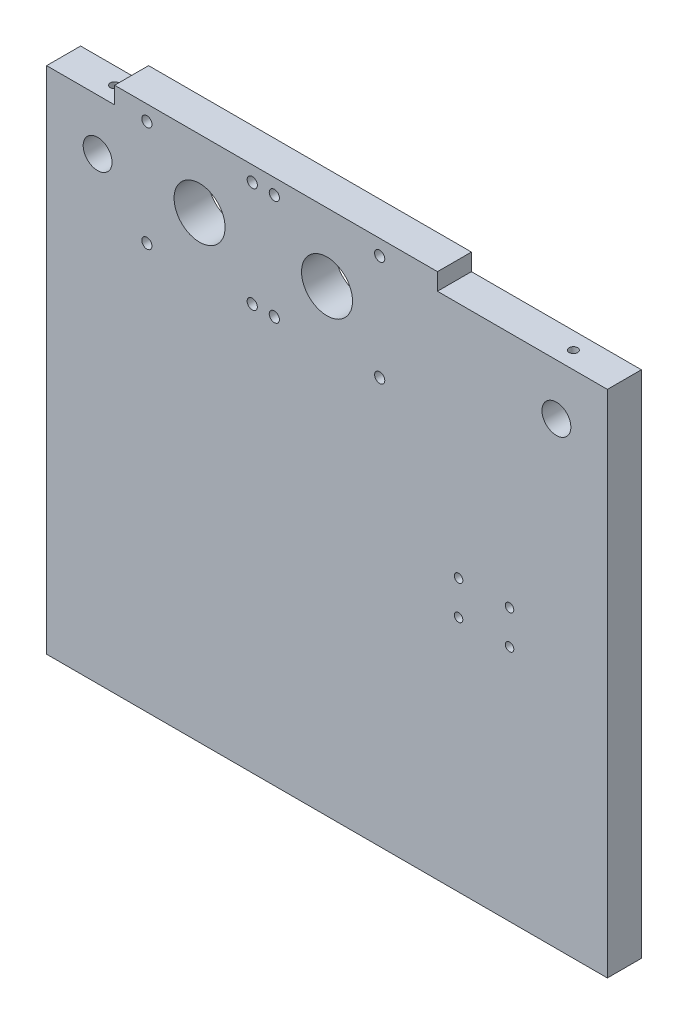
from build123d import *

# Parameters (mm, degrees)
ESQUISSE1_W             = 165
ESQUISSE1_H             = 150
BOSS_EXTRU_1_DEPTH      = 10
ESQUISSE2_R             = 4.25
ENL_V_MAT_EXTRU_1_DEPTH = 10
ESQUISSE5_W             = 95
ESQUISSE5_H             = 10
BOSS_EXTRU_2_DEPTH      = 5
ESQUISSE4_R             = 1.5
ESQUISSE4_R_2           = 7.5
ENL_V_MAT_EXTRU_2_DEPTH = 15
ESQUISSE6_R             = 1.25
ENL_V_MAT_EXTRU_3_DEPTH = 10
ESQUISSE7_W             = 30
ESQUISSE7_H             = 20
BOSS_EXTRU_3_DEPTH      = 30
ESQUISSE8_R             = 5.5
ESQUISSE8_R_2           = 2
ENL_V_MAT_EXTRU_4_DEPTH = 30
ESQUISSE8_4_R           = 11.5
ESQUISSE8_4_R_2         = 5.5
ESQUISSE8_4_R_3         = 2
ENL_V_MAT_EXTRU_5_DEPTH = 5
ESQUISSE9_R             = 1.25
ENL_V_MAT_EXTRU_6_DEPTH = 15


with BuildPart() as part:
    # Esquisse1 → Boss.-Extru.1 (new body)
    with BuildSketch(Plane.XY):
        Rectangle(ESQUISSE1_W, ESQUISSE1_H)
    extrude(amount=BOSS_EXTRU_1_DEPTH)

    # Esquisse2 → Enlèv. mat.-Extru.1 (cut)
    with BuildSketch(Plane.XY.offset(10)):
        with Locations((-67.5, 60)):
            Circle(ESQUISSE2_R)
        with Locations((67.5, 60)):
            Circle(ESQUISSE2_R)
    extrude(amount=-ENL_V_MAT_EXTRU_1_DEPTH, mode=Mode.SUBTRACT)

    # Esquisse5 → Boss.-Extru.2 (add)
    with BuildSketch(Plane(origin=(0, 75, 0), x_dir=(1, 0, 0), z_dir=(0, 1, 0))):
        with Locations((-15, -5)):
            Rectangle(ESQUISSE5_W, ESQUISSE5_H)
    extrude(amount=BOSS_EXTRU_2_DEPTH)

    # Esquisse4 → Enlèv. mat.-Extru.2 (cut)
    with BuildSketch(Plane.XY.offset(10)):
        with Locations((-15.5, 75.5)):
            Circle(ESQUISSE4_R)
        with Locations((15.5, 75.5)):
            Circle(ESQUISSE4_R)
        with Locations((15.5, 44.5)):
            Circle(ESQUISSE4_R)
        with Locations((-15.5, 44.5)):
            Circle(ESQUISSE4_R)
        with Locations((0, 60)):
            Circle(ESQUISSE4_R_2)
        with Locations((-53, 75.5)):
            Circle(ESQUISSE4_R)
        with Locations((-22, 75.5)):
            Circle(ESQUISSE4_R)
        with Locations((-22, 44.5)):
            Circle(ESQUISSE4_R)
        with Locations((-53, 44.5)):
            Circle(ESQUISSE4_R)
        with Locations((-37.5, 60)):
            Circle(ESQUISSE4_R_2)
    extrude(amount=-ENL_V_MAT_EXTRU_2_DEPTH, mode=Mode.SUBTRACT)

    # Esquisse6 → Enlèv. mat.-Extru.3 (cut)
    with BuildSketch(Plane.XY.offset(10)):
        with Locations((38.715061684, 5)):
            Circle(ESQUISSE6_R)
        with Locations((53.715061684, 5)):
            Circle(ESQUISSE6_R)
        with Locations((53.715061684, -5)):
            Circle(ESQUISSE6_R)
        with Locations((38.715061684, -5)):
            Circle(ESQUISSE6_R)
    extrude(amount=-ENL_V_MAT_EXTRU_3_DEPTH, mode=Mode.SUBTRACT)

    # Esquisse7 → Boss.-Extru.3 (add)
    with BuildSketch(Plane(origin=(0, 0, 0), x_dir=(-1, 0, 0), z_dir=(0, 0, -1))):
        Rectangle(ESQUISSE7_W, ESQUISSE7_H)
    extrude(amount=BOSS_EXTRU_3_DEPTH)

    # Esquisse8 → Enlèv. mat.-Extru.4 (cut)
    with BuildSketch(Plane(origin=(0, 10, 0), x_dir=(1, 0, 0), z_dir=(0, 1, 0))):
        with Locations((0, 15)):
            Circle(ESQUISSE8_R)
        with Locations((0, 23)):
            Circle(ESQUISSE8_R_2)
        with Locations((8, 15)):
            Circle(ESQUISSE8_R_2)
        with Locations((0, 7)):
            Circle(ESQUISSE8_R_2)
        with Locations((-8, 15)):
            Circle(ESQUISSE8_R_2)
    extrude(amount=-ENL_V_MAT_EXTRU_4_DEPTH, mode=Mode.SUBTRACT)

    # Esquisse8<4> → Enlèv. mat.-Extru.5 (cut)
    with BuildSketch(Plane(origin=(0, 10, 0), x_dir=(1, 0, 0), z_dir=(0, 1, 0))):
        with Locations((0, 15)):
            Circle(ESQUISSE8_4_R)
        with Locations((0, 15)):
            Circle(ESQUISSE8_4_R_2, mode=Mode.SUBTRACT)
        with Locations((0, 23)):
            Circle(ESQUISSE8_4_R_3, mode=Mode.SUBTRACT)
        with Locations((8, 15)):
            Circle(ESQUISSE8_4_R_3, mode=Mode.SUBTRACT)
        with Locations((0, 7)):
            Circle(ESQUISSE8_4_R_3, mode=Mode.SUBTRACT)
        with Locations((-8, 15)):
            Circle(ESQUISSE8_4_R_3, mode=Mode.SUBTRACT)
    extrude(amount=-ENL_V_MAT_EXTRU_5_DEPTH, mode=Mode.SUBTRACT)

    # Esquisse9 → Enlèv. mat.-Extru.6 (cut)
    with BuildSketch(Plane(origin=(0, 75, 0), x_dir=(1, 0, 0), z_dir=(0, 1, 0))):
        with Locations((67.5, -5)):
            Circle(ESQUISSE9_R)
        with Locations((-67.5, -5)):
            Circle(ESQUISSE9_R)
    extrude(amount=-ENL_V_MAT_EXTRU_6_DEPTH, mode=Mode.SUBTRACT)


solid = part.part
